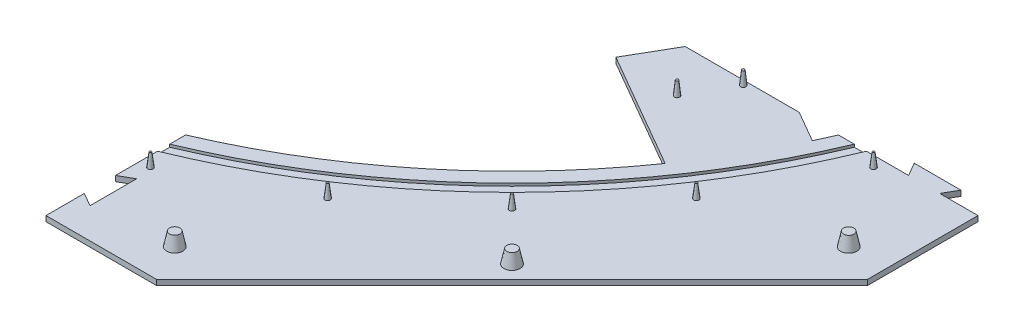
from build123d import *

# Parameters (mm, degrees)
BASEPLATE_PROFILE_DEPTH               = 2
SKETCH2_R                             = 1
M3_PINS_DEPTH                         = 5
M3_PINS_TAPER                         = 7
CIRPATTERN1_COUNT                     = 32
SKETCH4_R                             = 1
PILLAR_PINS_DEPTH                     = 5
PILLAR_PINS_DRAFT                     = 6
PILLAR_PINS_PROFILE_2_DEPTH           = 5
PILLAR_PINS_PROFILE_2_DRAFT           = 6
CIRPATTERN2_COPY_1_SKETCH_R           = 1
CIRPATTERN2_COPY_1_DEPTH              = 5
CIRPATTERN2_COPY_1_DRAFT              = 6
CIRPATTERN2_COPY_2_SKETCH_R           = 1
CIRPATTERN2_COPY_2_DEPTH              = 5
CIRPATTERN2_COPY_2_DRAFT              = 6
CIRPATTERN2_COPY_3_SKETCH_R           = 1
CIRPATTERN2_COPY_3_DEPTH              = 5
CIRPATTERN2_COPY_3_DRAFT              = 6
CIRPATTERN2_COPY_4_SKETCH_R           = 1
CIRPATTERN2_COPY_4_DEPTH              = 5
CIRPATTERN2_COPY_4_DRAFT              = 6
CIRPATTERN2_COPY_5_SKETCH_R           = 1
CIRPATTERN2_COPY_5_DEPTH              = 5
CIRPATTERN2_COPY_5_DRAFT              = 6
CIRPATTERN2_COPY_6_SKETCH_R           = 1
CIRPATTERN2_COPY_6_DEPTH              = 5
CIRPATTERN2_COPY_6_DRAFT              = 6
CIRPATTERN2_COPY_7_SKETCH_R           = 1
CIRPATTERN2_COPY_7_DEPTH              = 5
CIRPATTERN2_COPY_7_DRAFT              = 6
CIRPATTERN2_COPY_8_SKETCH_R           = 1
CIRPATTERN2_COPY_8_DEPTH              = 5
CIRPATTERN2_COPY_8_DRAFT              = 6
CIRPATTERN2_COPY_9_SKETCH_R           = 1
CIRPATTERN2_COPY_9_DEPTH              = 5
CIRPATTERN2_COPY_9_DRAFT              = 6
CIRPATTERN2_COPY_10_SKETCH_R          = 1
CIRPATTERN2_COPY_10_DEPTH             = 5
CIRPATTERN2_COPY_10_DRAFT             = 6
CIRPATTERN2_COPY_11_SKETCH_R          = 1
CIRPATTERN2_COPY_11_DEPTH             = 5
CIRPATTERN2_COPY_11_DRAFT             = 6
CIRPATTERN2_COPY_12_SKETCH_R          = 1
CIRPATTERN2_COPY_12_DEPTH             = 5
CIRPATTERN2_COPY_12_DRAFT             = 6
CIRPATTERN2_COPY_13_SKETCH_R          = 1
CIRPATTERN2_COPY_13_DEPTH             = 5
CIRPATTERN2_COPY_13_DRAFT             = 6
CIRPATTERN2_COPY_14_SKETCH_R          = 1
CIRPATTERN2_COPY_14_DEPTH             = 5
CIRPATTERN2_COPY_14_DRAFT             = 6
CIRPATTERN2_COPY_15_SKETCH_R          = 1
CIRPATTERN2_COPY_15_DEPTH             = 5
CIRPATTERN2_COPY_15_DRAFT             = 6
SKETCH5_R                             = 3
M8_HOLE_1_DEPTH                       = 5
M8_HOLE_1_TAPER                       = 12
M8_1_PATTERN_COUNT                    = 4
SKETCH6_R                             = 3
EXTRUDE_M8_2_DEPTH                    = 5
EXTRUDE_M8_2_TAPER                    = 12
M8_2_PATTERN_COUNT                    = 4
PATTERN_CIRCULAR_M8_3_COUNT           = 2
PATTERN_CIRCULAR_M8_3_ANGLE           = 36.9
PATTERN_CIRCULAR_M8_3_COPY_1_SKETCH_R = 3
PATTERN_CIRCULAR_M8_3_COPY_1_DEPTH    = 5
PATTERN_CIRCULAR_M8_3_COPY_1_TAPER    = 12
PATTERN_CIRCULAR_M8_3_COPY_2_SKETCH_R = 3
PATTERN_CIRCULAR_M8_3_COPY_2_DEPTH    = 5
PATTERN_CIRCULAR_M8_3_COPY_2_TAPER    = 12
PATTERN_CIRCULAR_M8_3_COPY_3_SKETCH_R = 3
PATTERN_CIRCULAR_M8_3_COPY_3_DEPTH    = 5
PATTERN_CIRCULAR_M8_3_COPY_3_TAPER    = 12
CUT_CENTER_DEPTH                      = 374.385859402
CIRPATTERN7_COUNT                     = 6
SKETCH16_W                            = 706.015434107
SKETCH16_H                            = 962.246603821
SKETCH16_W_2                          = 199
SKETCH16_H_2                          = 199
CUT_EXTRUDE4_DEPTH                    = 374.417996354
CUT_EXTRUDE5_DEPTH                    = 374.385859402
BOSS_EXTRUDE3_DEPTH                   = 2
SKETCH20_R                            = 240.5
SKETCH20_R_2                          = 236.3
CUT_EXTRUDE6_DEPTH                    = 1


with BuildPart() as part:
    # Sketch1 → baseplate profile (new body)
    with BuildSketch(Plane(origin=(0, 0, 0), x_dir=(1, 0, 0), z_dir=(0, 1, 0))):
        Polygon((264, 0), (264, 131.98), (131.979594929, 264), (0, 264), (-131.98, 264), (-264, 131.979594929), (-264, 0), (-264, -131.98), (-131.979594929, -264), (0, -264), (131.98, -264), (264, -131.979594929), align=None)
    extrude(amount=-BASEPLATE_PROFILE_DEPTH)

    # Sketch2 → M3 pins (add)
    with BuildSketch(Plane(origin=(0, 0, 0), x_dir=(1, 0, 0), z_dir=(0, 1, 0))):
        with Locations((0, 248)):
            Circle(SKETCH2_R)
    m3_pins = extrude(amount=M3_PINS_DEPTH, taper=M3_PINS_TAPER)

    # CirPattern1: M3 pins ×32 about axis
    cirpattern1_axis = Axis((0, 0, 0), (0, 1, 0))
    for i in range(1, CIRPATTERN1_COUNT):
        add(m3_pins.rotate(cirpattern1_axis, i * 360 / CIRPATTERN1_COUNT))


with BuildPart() as pillar_pins_tool:
    # Sketch4 → pillar pins (with draft: the straight prism first)
    with BuildSketch(Plane(origin=(0, 0, 0), x_dir=(1, 0, 0), z_dir=(0, 1, 0))):
        with Locations((9, 201)):
            Circle(SKETCH4_R)
    extrude(amount=PILLAR_PINS_DEPTH)
    # pillar pins: the draft: its side faces are tilted about the plane it starts from
    pillar_pins_sides = [pillar_pins_tool.faces().sort_by_distance(p)[0] for p in [
        (8, 2.5, -201),
    ]]
    draft(pillar_pins_sides, Plane(origin=(0, 0, 0), x_dir=(1, 0, 0), z_dir=(0, 1, 0)), PILLAR_PINS_DRAFT)


with BuildPart() as part_1:
    add(part.part)

    # pillar pins: add pillar_pins_tool
    add(pillar_pins_tool.part)


with BuildPart() as pillar_pins_profile_2_tool:
    # Sketch4 → pillar pins profile 2 (with draft: the straight prism first)
    with BuildSketch(Plane(origin=(0, 0, 0), x_dir=(1, 0, 0), z_dir=(0, 1, 0))):
        with Locations((-9, 201)):
            Circle(SKETCH4_R)
    extrude(amount=PILLAR_PINS_PROFILE_2_DEPTH)
    # pillar pins profile 2: the draft: its side faces are tilted about the plane it starts from
    pillar_pins_profile_2_sides = [pillar_pins_profile_2_tool.faces().sort_by_distance(p)[0] for p in [
        (-10, 2.5, -201),
    ]]
    draft(pillar_pins_profile_2_sides, Plane(origin=(0, 0, 0), x_dir=(1, 0, 0), z_dir=(0, 1, 0)), PILLAR_PINS_PROFILE_2_DRAFT)


with BuildPart() as part_2:
    add(part_1.part)

    # pillar pins profile 2: add pillar_pins_profile_2_tool
    add(pillar_pins_profile_2_tool.part)


with BuildPart() as cirpattern2_copy_1_tool:
    # CirPattern2 copy 1 sketch → CirPattern2 copy 1 (with draft: the straight prism first)
    with BuildSketch(Plane(origin=(0, 0, 0), x_dir=(0.5000000000000001, 0, -0.8660254037844386), z_dir=(0, 1, 0))):
        with Locations((9, 201)):
            Circle(CIRPATTERN2_COPY_1_SKETCH_R)
    extrude(amount=CIRPATTERN2_COPY_1_DEPTH)
    # CirPattern2 copy 1: the draft: its side faces are tilted about the plane it starts from
    cirpattern2_copy_1_sides = [cirpattern2_copy_1_tool.faces().sort_by_distance(p)[0] for p in [
        (-170.071106161, 2.5, -107.42820323),
    ]]
    draft(cirpattern2_copy_1_sides, Plane(origin=(0, 0, 0), x_dir=(0.5000000000000001, 0, -0.8660254037844386), z_dir=(0, 1, 0)), CIRPATTERN2_COPY_1_DRAFT)


with BuildPart() as part_3:
    add(part_2.part)

    # CirPattern2 copy 1: add cirpattern2_copy_1_tool
    add(cirpattern2_copy_1_tool.part)


with BuildPart() as cirpattern2_copy_2_tool:
    # CirPattern2 copy 2 sketch → CirPattern2 copy 2 (with draft: the straight prism first)
    with BuildSketch(Plane(origin=(0, 0, 0), x_dir=(-0.4999999999999998, 0, -0.8660254037844387), z_dir=(0, 1, 0))):
        with Locations((9, 201)):
            Circle(CIRPATTERN2_COPY_2_SKETCH_R)
    extrude(amount=CIRPATTERN2_COPY_2_DEPTH)
    # CirPattern2 copy 2: the draft: its side faces are tilted about the plane it starts from
    cirpattern2_copy_2_sides = [cirpattern2_copy_2_tool.faces().sort_by_distance(p)[0] for p in [
        (-178.071106161, 2.5, 93.57179677),
    ]]
    draft(cirpattern2_copy_2_sides, Plane(origin=(0, 0, 0), x_dir=(-0.4999999999999998, 0, -0.8660254037844387), z_dir=(0, 1, 0)), CIRPATTERN2_COPY_2_DRAFT)


with BuildPart() as part_4:
    add(part_3.part)

    # CirPattern2 copy 2: add cirpattern2_copy_2_tool
    add(cirpattern2_copy_2_tool.part)


with BuildPart() as cirpattern2_copy_3_tool:
    # CirPattern2 copy 3 sketch → CirPattern2 copy 3 (with draft: the straight prism first)
    with BuildSketch(Plane(origin=(0, 0, 0), x_dir=(-1, 0, 0), z_dir=(0, 1, 0))):
        with Locations((9, 201)):
            Circle(CIRPATTERN2_COPY_3_SKETCH_R)
    extrude(amount=CIRPATTERN2_COPY_3_DEPTH)
    # CirPattern2 copy 3: the draft: its side faces are tilted about the plane it starts from
    cirpattern2_copy_3_sides = [cirpattern2_copy_3_tool.faces().sort_by_distance(p)[0] for p in [
        (-8, 2.5, 201),
    ]]
    draft(cirpattern2_copy_3_sides, Plane(origin=(0, 0, 0), x_dir=(-1, 0, 0), z_dir=(0, 1, 0)), CIRPATTERN2_COPY_3_DRAFT)


with BuildPart() as part_5:
    add(part_4.part)

    # CirPattern2 copy 3: add cirpattern2_copy_3_tool
    add(cirpattern2_copy_3_tool.part)


with BuildPart() as cirpattern2_copy_4_tool:
    # CirPattern2 copy 4 sketch → CirPattern2 copy 4 (with draft: the straight prism first)
    with BuildSketch(Plane(origin=(0, 0, 0), x_dir=(-0.5000000000000004, 0, 0.8660254037844384), z_dir=(0, 1, 0))):
        with Locations((9, 201)):
            Circle(CIRPATTERN2_COPY_4_SKETCH_R)
    extrude(amount=CIRPATTERN2_COPY_4_DEPTH)
    # CirPattern2 copy 4: the draft: its side faces are tilted about the plane it starts from
    cirpattern2_copy_4_sides = [cirpattern2_copy_4_tool.faces().sort_by_distance(p)[0] for p in [
        (170.071106161, 2.5, 107.42820323),
    ]]
    draft(cirpattern2_copy_4_sides, Plane(origin=(0, 0, 0), x_dir=(-0.5000000000000004, 0, 0.8660254037844384), z_dir=(0, 1, 0)), CIRPATTERN2_COPY_4_DRAFT)


with BuildPart() as part_6:
    add(part_5.part)

    # CirPattern2 copy 4: add cirpattern2_copy_4_tool
    add(cirpattern2_copy_4_tool.part)


with BuildPart() as cirpattern2_copy_5_tool:
    # CirPattern2 copy 5 sketch → CirPattern2 copy 5 (with draft: the straight prism first)
    with BuildSketch(Plane(origin=(0, 0, 0), x_dir=(0.5000000000000001, 0, 0.8660254037844386), z_dir=(0, 1, 0))):
        with Locations((9, 201)):
            Circle(CIRPATTERN2_COPY_5_SKETCH_R)
    extrude(amount=CIRPATTERN2_COPY_5_DEPTH)
    # CirPattern2 copy 5: the draft: its side faces are tilted about the plane it starts from
    cirpattern2_copy_5_sides = [cirpattern2_copy_5_tool.faces().sort_by_distance(p)[0] for p in [
        (178.071106161, 2.5, -93.57179677),
    ]]
    draft(cirpattern2_copy_5_sides, Plane(origin=(0, 0, 0), x_dir=(0.5000000000000001, 0, 0.8660254037844386), z_dir=(0, 1, 0)), CIRPATTERN2_COPY_5_DRAFT)


with BuildPart() as part_7:
    add(part_6.part)

    # CirPattern2 copy 5: add cirpattern2_copy_5_tool
    add(cirpattern2_copy_5_tool.part)


with BuildPart() as cirpattern2_copy_6_tool:
    # CirPattern2 copy 6 sketch → CirPattern2 copy 6 (with draft: the straight prism first)
    with BuildSketch(Plane(origin=(0, 0, 0), x_dir=(0.5000000000000001, 0, -0.8660254037844386), z_dir=(0, 1, 0))):
        with Locations((-9, 201)):
            Circle(CIRPATTERN2_COPY_6_SKETCH_R)
    extrude(amount=CIRPATTERN2_COPY_6_DEPTH)
    # CirPattern2 copy 6: the draft: its side faces are tilted about the plane it starts from
    cirpattern2_copy_6_sides = [cirpattern2_copy_6_tool.faces().sort_by_distance(p)[0] for p in [
        (-179.071106161, 2.5, -91.839745962),
    ]]
    draft(cirpattern2_copy_6_sides, Plane(origin=(0, 0, 0), x_dir=(0.5000000000000001, 0, -0.8660254037844386), z_dir=(0, 1, 0)), CIRPATTERN2_COPY_6_DRAFT)


with BuildPart() as part_8:
    add(part_7.part)

    # CirPattern2 copy 6: add cirpattern2_copy_6_tool
    add(cirpattern2_copy_6_tool.part)


with BuildPart() as cirpattern2_copy_7_tool:
    # CirPattern2 copy 7 sketch → CirPattern2 copy 7 (with draft: the straight prism first)
    with BuildSketch(Plane(origin=(0, 0, 0), x_dir=(-0.4999999999999998, 0, -0.8660254037844387), z_dir=(0, 1, 0))):
        with Locations((-9, 201)):
            Circle(CIRPATTERN2_COPY_7_SKETCH_R)
    extrude(amount=CIRPATTERN2_COPY_7_DEPTH)
    # CirPattern2 copy 7: the draft: its side faces are tilted about the plane it starts from
    cirpattern2_copy_7_sides = [cirpattern2_copy_7_tool.faces().sort_by_distance(p)[0] for p in [
        (-169.071106161, 2.5, 109.160254038),
    ]]
    draft(cirpattern2_copy_7_sides, Plane(origin=(0, 0, 0), x_dir=(-0.4999999999999998, 0, -0.8660254037844387), z_dir=(0, 1, 0)), CIRPATTERN2_COPY_7_DRAFT)


with BuildPart() as part_9:
    add(part_8.part)

    # CirPattern2 copy 7: add cirpattern2_copy_7_tool
    add(cirpattern2_copy_7_tool.part)


with BuildPart() as cirpattern2_copy_8_tool:
    # CirPattern2 copy 8 sketch → CirPattern2 copy 8 (with draft: the straight prism first)
    with BuildSketch(Plane(origin=(0, 0, 0), x_dir=(-1, 0, 0), z_dir=(0, 1, 0))):
        with Locations((-9, 201)):
            Circle(CIRPATTERN2_COPY_8_SKETCH_R)
    extrude(amount=CIRPATTERN2_COPY_8_DEPTH)
    # CirPattern2 copy 8: the draft: its side faces are tilted about the plane it starts from
    cirpattern2_copy_8_sides = [cirpattern2_copy_8_tool.faces().sort_by_distance(p)[0] for p in [
        (10, 2.5, 201),
    ]]
    draft(cirpattern2_copy_8_sides, Plane(origin=(0, 0, 0), x_dir=(-1, 0, 0), z_dir=(0, 1, 0)), CIRPATTERN2_COPY_8_DRAFT)


with BuildPart() as part_10:
    add(part_9.part)

    # CirPattern2 copy 8: add cirpattern2_copy_8_tool
    add(cirpattern2_copy_8_tool.part)


with BuildPart() as cirpattern2_copy_9_tool:
    # CirPattern2 copy 9 sketch → CirPattern2 copy 9 (with draft: the straight prism first)
    with BuildSketch(Plane(origin=(0, 0, 0), x_dir=(-0.5000000000000004, 0, 0.8660254037844384), z_dir=(0, 1, 0))):
        with Locations((-9, 201)):
            Circle(CIRPATTERN2_COPY_9_SKETCH_R)
    extrude(amount=CIRPATTERN2_COPY_9_DEPTH)
    # CirPattern2 copy 9: the draft: its side faces are tilted about the plane it starts from
    cirpattern2_copy_9_sides = [cirpattern2_copy_9_tool.faces().sort_by_distance(p)[0] for p in [
        (179.071106161, 2.5, 91.839745962),
    ]]
    draft(cirpattern2_copy_9_sides, Plane(origin=(0, 0, 0), x_dir=(-0.5000000000000004, 0, 0.8660254037844384), z_dir=(0, 1, 0)), CIRPATTERN2_COPY_9_DRAFT)


with BuildPart() as part_11:
    add(part_10.part)

    # CirPattern2 copy 9: add cirpattern2_copy_9_tool
    add(cirpattern2_copy_9_tool.part)


with BuildPart() as cirpattern2_copy_10_tool:
    # CirPattern2 copy 10 sketch → CirPattern2 copy 10 (with draft: the straight prism first)
    with BuildSketch(Plane(origin=(0, 0, 0), x_dir=(0.5000000000000001, 0, 0.8660254037844386), z_dir=(0, 1, 0))):
        with Locations((-9, 201)):
            Circle(CIRPATTERN2_COPY_10_SKETCH_R)
    extrude(amount=CIRPATTERN2_COPY_10_DEPTH)
    # CirPattern2 copy 10: the draft: its side faces are tilted about the plane it starts from
    cirpattern2_copy_10_sides = [cirpattern2_copy_10_tool.faces().sort_by_distance(p)[0] for p in [
        (169.071106161, 2.5, -109.160254038),
    ]]
    draft(cirpattern2_copy_10_sides, Plane(origin=(0, 0, 0), x_dir=(0.5000000000000001, 0, 0.8660254037844386), z_dir=(0, 1, 0)), CIRPATTERN2_COPY_10_DRAFT)


with BuildPart() as part_12:
    add(part_11.part)

    # CirPattern2 copy 10: add cirpattern2_copy_10_tool
    add(cirpattern2_copy_10_tool.part)


with BuildPart() as cirpattern2_copy_11_tool:
    # CirPattern2 copy 11 sketch → CirPattern2 copy 11 (with draft: the straight prism first)
    with BuildSketch(Plane(origin=(0, 0, 0), x_dir=(0.5000000000000001, 0, -0.8660254037844386), z_dir=(0, 1, 0))):
        with Locations((-9, 201)):
            Circle(CIRPATTERN2_COPY_11_SKETCH_R)
    extrude(amount=CIRPATTERN2_COPY_11_DEPTH)
    # CirPattern2 copy 11: the draft: its side faces are tilted about the plane it starts from
    cirpattern2_copy_11_sides = [cirpattern2_copy_11_tool.faces().sort_by_distance(p)[0] for p in [
        (-179.071106161, 2.5, -91.839745962),
    ]]
    draft(cirpattern2_copy_11_sides, Plane(origin=(0, 0, 0), x_dir=(0.5000000000000001, 0, -0.8660254037844386), z_dir=(0, 1, 0)), CIRPATTERN2_COPY_11_DRAFT)


with BuildPart() as part_13:
    add(part_12.part)

    # CirPattern2 copy 11: add cirpattern2_copy_11_tool
    add(cirpattern2_copy_11_tool.part)


with BuildPart() as cirpattern2_copy_12_tool:
    # CirPattern2 copy 12 sketch → CirPattern2 copy 12 (with draft: the straight prism first)
    with BuildSketch(Plane(origin=(0, 0, 0), x_dir=(-0.4999999999999998, 0, -0.8660254037844387), z_dir=(0, 1, 0))):
        with Locations((-9, 201)):
            Circle(CIRPATTERN2_COPY_12_SKETCH_R)
    extrude(amount=CIRPATTERN2_COPY_12_DEPTH)
    # CirPattern2 copy 12: the draft: its side faces are tilted about the plane it starts from
    cirpattern2_copy_12_sides = [cirpattern2_copy_12_tool.faces().sort_by_distance(p)[0] for p in [
        (-169.071106161, 2.5, 109.160254038),
    ]]
    draft(cirpattern2_copy_12_sides, Plane(origin=(0, 0, 0), x_dir=(-0.4999999999999998, 0, -0.8660254037844387), z_dir=(0, 1, 0)), CIRPATTERN2_COPY_12_DRAFT)


with BuildPart() as part_14:
    add(part_13.part)

    # CirPattern2 copy 12: add cirpattern2_copy_12_tool
    add(cirpattern2_copy_12_tool.part)


with BuildPart() as cirpattern2_copy_13_tool:
    # CirPattern2 copy 13 sketch → CirPattern2 copy 13 (with draft: the straight prism first)
    with BuildSketch(Plane(origin=(0, 0, 0), x_dir=(-1, 0, 0), z_dir=(0, 1, 0))):
        with Locations((-9, 201)):
            Circle(CIRPATTERN2_COPY_13_SKETCH_R)
    extrude(amount=CIRPATTERN2_COPY_13_DEPTH)
    # CirPattern2 copy 13: the draft: its side faces are tilted about the plane it starts from
    cirpattern2_copy_13_sides = [cirpattern2_copy_13_tool.faces().sort_by_distance(p)[0] for p in [
        (10, 2.5, 201),
    ]]
    draft(cirpattern2_copy_13_sides, Plane(origin=(0, 0, 0), x_dir=(-1, 0, 0), z_dir=(0, 1, 0)), CIRPATTERN2_COPY_13_DRAFT)


with BuildPart() as part_15:
    add(part_14.part)

    # CirPattern2 copy 13: add cirpattern2_copy_13_tool
    add(cirpattern2_copy_13_tool.part)


with BuildPart() as cirpattern2_copy_14_tool:
    # CirPattern2 copy 14 sketch → CirPattern2 copy 14 (with draft: the straight prism first)
    with BuildSketch(Plane(origin=(0, 0, 0), x_dir=(-0.5000000000000004, 0, 0.8660254037844384), z_dir=(0, 1, 0))):
        with Locations((-9, 201)):
            Circle(CIRPATTERN2_COPY_14_SKETCH_R)
    extrude(amount=CIRPATTERN2_COPY_14_DEPTH)
    # CirPattern2 copy 14: the draft: its side faces are tilted about the plane it starts from
    cirpattern2_copy_14_sides = [cirpattern2_copy_14_tool.faces().sort_by_distance(p)[0] for p in [
        (179.071106161, 2.5, 91.839745962),
    ]]
    draft(cirpattern2_copy_14_sides, Plane(origin=(0, 0, 0), x_dir=(-0.5000000000000004, 0, 0.8660254037844384), z_dir=(0, 1, 0)), CIRPATTERN2_COPY_14_DRAFT)


with BuildPart() as part_16:
    add(part_15.part)

    # CirPattern2 copy 14: add cirpattern2_copy_14_tool
    add(cirpattern2_copy_14_tool.part)


with BuildPart() as cirpattern2_copy_15_tool:
    # CirPattern2 copy 15 sketch → CirPattern2 copy 15 (with draft: the straight prism first)
    with BuildSketch(Plane(origin=(0, 0, 0), x_dir=(0.5000000000000001, 0, 0.8660254037844386), z_dir=(0, 1, 0))):
        with Locations((-9, 201)):
            Circle(CIRPATTERN2_COPY_15_SKETCH_R)
    extrude(amount=CIRPATTERN2_COPY_15_DEPTH)
    # CirPattern2 copy 15: the draft: its side faces are tilted about the plane it starts from
    cirpattern2_copy_15_sides = [cirpattern2_copy_15_tool.faces().sort_by_distance(p)[0] for p in [
        (169.071106161, 2.5, -109.160254038),
    ]]
    draft(cirpattern2_copy_15_sides, Plane(origin=(0, 0, 0), x_dir=(0.5000000000000001, 0, 0.8660254037844386), z_dir=(0, 1, 0)), CIRPATTERN2_COPY_15_DRAFT)


with BuildPart() as part_17:
    add(part_16.part)

    # CirPattern2 copy 15: add cirpattern2_copy_15_tool
    add(cirpattern2_copy_15_tool.part)

    # Sketch5 → M8 hole -1 (add)
    with BuildSketch(Plane(origin=(0, 0, 0), x_dir=(1, 0, 0), z_dir=(0, 1, 0))):
        with Locations((-193.040151264, 193.040151264)):
            Circle(SKETCH5_R)
    m8_hole_1 = extrude(amount=M8_HOLE_1_DEPTH, taper=M8_HOLE_1_TAPER)

    # M8 -1 pattern: M8 hole -1 ×4 about axis
    m8_1_pattern_axis = Axis((0, 0, 0), (0, 1, 0))
    for i in range(1, M8_1_PATTERN_COUNT):
        add(m8_hole_1.rotate(m8_1_pattern_axis, i * 360 / M8_1_PATTERN_COUNT))

    # Sketch6 → M8 -2 (add)
    with BuildSketch(Plane(origin=(0, 0, 0), x_dir=(1, 0, 0), z_dir=(0, 1, 0))):
        with Locations((-125, -250)):
            Circle(SKETCH6_R)
    extrude_m8_2 = extrude(amount=EXTRUDE_M8_2_DEPTH, taper=EXTRUDE_M8_2_TAPER)

    # M8 -2 pattern: M8 -2 ×4 about axis
    m8_2_pattern_axis = Axis((0, 0, 0), (0, 1, 0))
    for i in range(1, M8_2_PATTERN_COUNT):
        add(extrude_m8_2.rotate(m8_2_pattern_axis, i * 360 / M8_2_PATTERN_COUNT))

    # M8 -3: M8 -2 ×2 about axis
    pattern_circular_m8_3_axis = Axis((0, 0, 0), (0, -1, 0))
    for i in range(1, PATTERN_CIRCULAR_M8_3_COUNT):
        add(extrude_m8_2.rotate(pattern_circular_m8_3_axis, i * PATTERN_CIRCULAR_M8_3_ANGLE / (PATTERN_CIRCULAR_M8_3_COUNT - 1)))

    # M8 -3 copy 1 sketch → M8 -3 copy 1 (add)
    with BuildSketch(Plane(origin=(0, 0, 0), x_dir=(0.6004202253258852, 0, -0.7996846584870897), z_dir=(0, 1, 0))):
        with Locations((-125, -250)):
            Circle(PATTERN_CIRCULAR_M8_3_COPY_1_SKETCH_R)
    extrude(amount=PATTERN_CIRCULAR_M8_3_COPY_1_DEPTH, taper=PATTERN_CIRCULAR_M8_3_COPY_1_TAPER)

    # M8 -3 copy 2 sketch → M8 -3 copy 2 (add)
    with BuildSketch(Plane(origin=(0, 0, 0), x_dir=(-0.7996846584870896, 0, -0.6004202253258853), z_dir=(0, 1, 0))):
        with Locations((-125, -250)):
            Circle(PATTERN_CIRCULAR_M8_3_COPY_2_SKETCH_R)
    extrude(amount=PATTERN_CIRCULAR_M8_3_COPY_2_DEPTH, taper=PATTERN_CIRCULAR_M8_3_COPY_2_TAPER)

    # M8 -3 copy 3 sketch → M8 -3 copy 3 (add)
    with BuildSketch(Plane(origin=(0, 0, 0), x_dir=(-0.6004202253258853, 0, 0.7996846584870896), z_dir=(0, 1, 0))):
        with Locations((-125, -250)):
            Circle(PATTERN_CIRCULAR_M8_3_COPY_3_SKETCH_R)
    extrude(amount=PATTERN_CIRCULAR_M8_3_COPY_3_DEPTH, taper=PATTERN_CIRCULAR_M8_3_COPY_3_TAPER)

    # Sketch8 → cut center (cut, through all)
    with BuildSketch(Plane(origin=(0, 0, 0), x_dir=(1, 0, 0), z_dir=(0, 1, 0))):
        with BuildLine():
            Line((115.433963806, -199.937490231), (0, 0))
            Line((0, 0), (0, -180))
            Line((0, -180), (20, -180))
            Line((20, -180), (20, -230))
            ThreePointArc((20, -230), (69.365180469, -220.200980331), (115.433963806, -199.937490231))
        make_face()
        with BuildLine():
            Line((0, -180), (0, 0))
            Line((0, 0), (-115.433963806, -199.937490231))
            ThreePointArc((-115.433963806, -199.937490231), (-69.365180469, -220.200980331), (-20, -230))
            Line((-20, -230), (-20, -180))
            Line((-20, -180), (0, -180))
        make_face()
    cut_center = extrude(amount=-CUT_CENTER_DEPTH, mode=Mode.SUBTRACT)

    # CirPattern7: cut center ×6 about axis
    cirpattern7_axis = Axis((0, 0, 0), (0, 1, 0))
    for i in range(1, CIRPATTERN7_COUNT):
        add(cut_center.rotate(cirpattern7_axis, i * 360 / CIRPATTERN7_COUNT), mode=Mode.SUBTRACT)

    # Sketch16 → Cut-Extrude4 (cut, through all)
    with BuildSketch(Plane.XZ.offset(2)):
        with Locations((12.105337572, -26.075320592)):
            Rectangle(SKETCH16_W, SKETCH16_H)
        with Locations((190.5, 190.5)):
            Rectangle(SKETCH16_W_2, SKETCH16_H_2, mode=Mode.SUBTRACT)
    extrude(amount=-CUT_EXTRUDE4_DEPTH, mode=Mode.SUBTRACT)

    # Sketch17 → Cut-Extrude5 (cut, through all)
    with BuildSketch(Plane(origin=(0, 0, 0), x_dir=(1, 0, 0), z_dir=(0, 1, 0))):
        Polygon((81, -244), (96, -252.660254038), (96, -235.339745962), align=None)
    extrude(amount=-CUT_EXTRUDE5_DEPTH, mode=Mode.SUBTRACT)

    # Sketch19 → Boss-Extrude3 (add)
    with BuildSketch(Plane(origin=(0, -2, 0), x_dir=(-1, 0, 0), z_dir=(0, -1, 0))):
        Polygon((-235.339745962, -86), (-252.660254038, -86), (-244, -101), align=None)
    extrude(amount=-BOSS_EXTRUDE3_DEPTH)

    # Sketch20 → Cut-Extrude6 (cut)
    with BuildSketch(Plane(origin=(0, 0, 0), x_dir=(1, 0, 0), z_dir=(0, 1, 0))):
        Circle(SKETCH20_R)
        Circle(SKETCH20_R_2, mode=Mode.SUBTRACT)
    extrude(amount=-CUT_EXTRUDE6_DEPTH, mode=Mode.SUBTRACT)


solid = part_17.part
